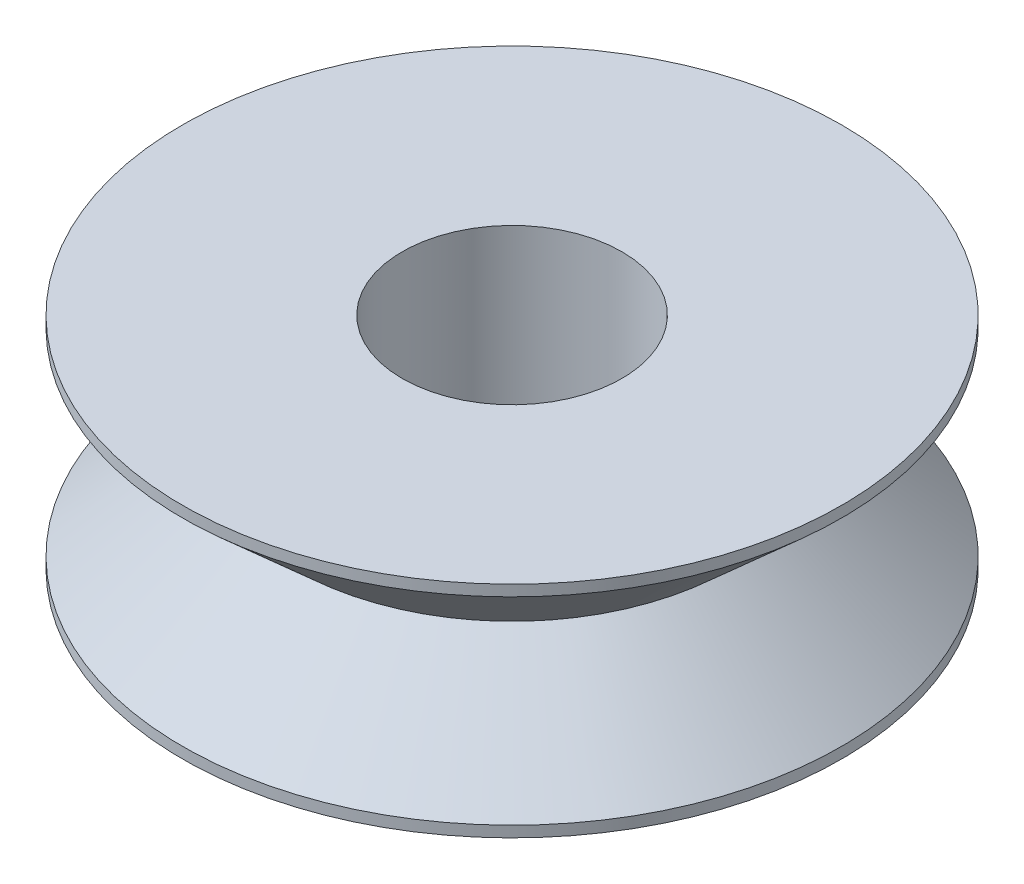
from build123d import *


with BuildPart() as part:
    # 草图1 → 旋转1 (revolve)
    with BuildSketch(Plane.XY, mode=Mode.PRIVATE) as revolve_1_sk:
        Polygon((2, 0), (6, 0), (6, 0.2), (4, 2), (6, 3.8), (6, 4), (2, 4), align=None)
    revolve(revolve_1_sk.sketch.rotate(Axis((0, 0, 0), (0, 1, 0)), 90), axis=Axis((0, 0, 0), (0, 1, 0)))


solid = part.part
